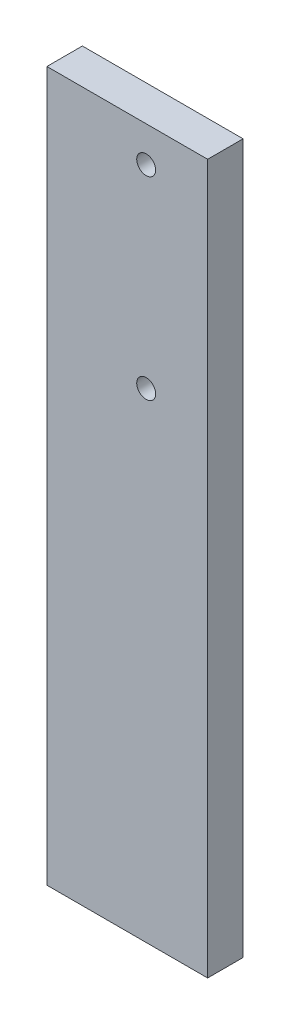
from build123d import *

# Parameters (mm, degrees)
CROQUIS1_W              = 68
CROQUIS1_H              = 300
CROQUIS1_R              = 4
SALIENTE_EXTRUIR1_DEPTH = 15


with BuildPart() as part:
    # Croquis1 → Saliente-Extruir1 (new body)
    with BuildSketch(Plane.XY):
        with Locations((34, 150)):
            Rectangle(CROQUIS1_W, CROQUIS1_H)
        with Locations((42, 285)):
            Circle(CROQUIS1_R, mode=Mode.SUBTRACT)
        with Locations((42, 203)):
            Circle(CROQUIS1_R, mode=Mode.SUBTRACT)
    extrude(amount=SALIENTE_EXTRUIR1_DEPTH)


solid = part.part
